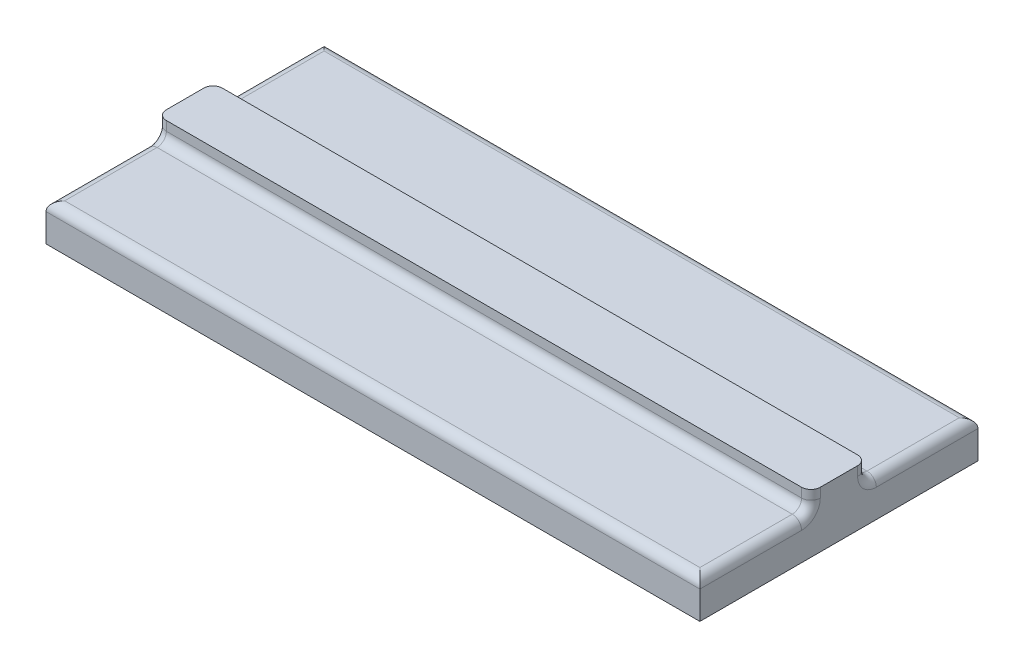
from build123d import *

# Parameters (mm, degrees)
SALIENTE_EXTRUIR1_DEPTH = 175
REDONDEO1_R             = 5


with BuildPart() as part:
    # Croquis1 → Saliente-Extruir1 (new, symmetric)
    with BuildSketch(Plane(origin=(0, 0, 0), x_dir=(0, 0, -1), z_dir=(1, 0, 0))):
        Polygon((74.427480916, 0), (-74.427480916, 0), (-74.427480916, 20), (-15, 20), (-15, 30), (15, 30), (15, 20), (74.427480916, 20), align=None)
    extrude(amount=SALIENTE_EXTRUIR1_DEPTH, both=True)

    # Redondeo1
    redondeo1_edges = [part.edges().sort_by_distance(p)[0] for p in [
        (-175, 25, -15),
        (-175, 20, -44.713740458),
        (175, 25, -15),
        (0, 20, 74.427480916),
        (0, 20, 15),
        (0, 20, -15),
        (0, 20, -74.427480916),
        (175, 25, 15),
        (175, 20, 44.713740458),
        (175, 20, -44.713740458),
        (-175, 20, 44.713740458),
        (-175, 25, 15),
    ]]
    fillet(redondeo1_edges, radius=REDONDEO1_R)


solid = part.part
